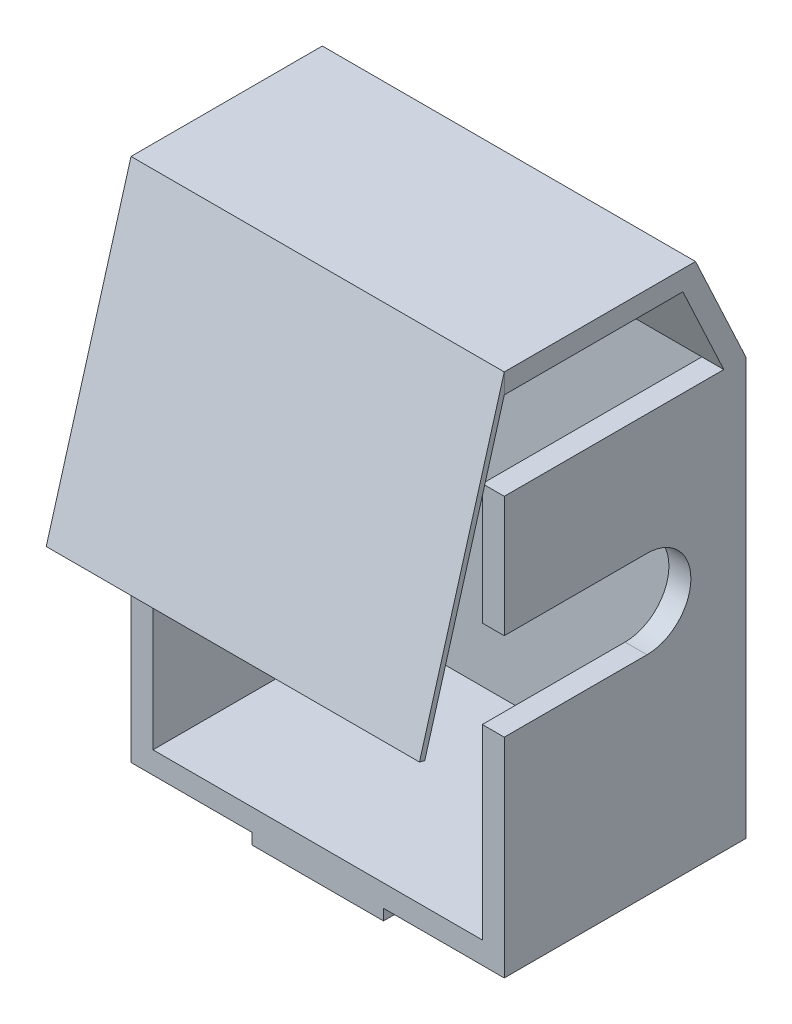
from build123d import *

# Parameters (mm, degrees)
BOSS_EXTRUDE1_DEPTH = 69.85
BOSS_EXTRUDE2_DEPTH = 228.6
BOSS_EXTRUDE3_DEPTH = 215.9
BOSS_EXTRUDE4_DEPTH = 215.9
CUT_EXTRUDE1_DEPTH  = 12.7


with BuildPart() as part:
    # Sketch1 → Boss-Extrude1 (new, symmetric)
    with BuildSketch(Plane.XY):
        Polygon((-107.95, 19.05), (107.95, 19.05), (107.95, 6.35), (38.1, 6.35), (38.1, 0), (-38.1, 0), (-38.1, 6.35), (-107.95, 6.35), align=None)
    extrude(amount=BOSS_EXTRUDE1_DEPTH, both=True)

    # Sketch2 → Boss-Extrude2 (add)
    with BuildSketch(Plane(origin=(0, 19.05, 0), x_dir=(1, 0, 0), z_dir=(0, 1, 0))):
        Polygon((107.95, 69.85), (-107.95, 69.85), (-107.95, -69.85), (-95.25, -69.85), (-95.25, 57.15), (95.25, 57.15), (95.25, -69.85), (107.95, -69.85), align=None)
    extrude(amount=BOSS_EXTRUDE2_DEPTH)

    # Sketch3 → Boss-Extrude3 (add, through all)
    with BuildSketch(Plane(origin=(107.95, 0, 0), x_dir=(0, 0, -1), z_dir=(1, 0, 0))):
        Polygon((57.15, 247.65), (69.85, 247.65), (40.794319042, 309.960108895), (-69.85, 309.960108895), (-69.85, 298.45), (33.461570966, 298.45), align=None)
    extrude(amount=-BOSS_EXTRUDE3_DEPTH)

    # Sketch5 → Cut-Extrude1 (cut)
    with BuildSketch(Plane(origin=(107.95, 0, 0), x_dir=(0, 0, -1), z_dir=(1, 0, 0))):
        with BuildLine():
            Line((12.7, 177.8), (-69.85, 177.8))
            Line((-69.85, 177.8), (-69.85, 127))
            Line((-69.85, 127), (12.7, 127))
            ThreePointArc((12.7, 127), (38.1, 152.4), (12.7, 177.8))
        make_face()
    extrude(amount=-CUT_EXTRUDE1_DEPTH, mode=Mode.SUBTRACT)


with BuildPart() as body_2:
    # Sketch4 → Boss-Extrude4 (new body)
    with BuildSketch(Plane(origin=(107.95, 0, 0), x_dir=(0, 0, -1), z_dir=(1, 0, 0))):
        Polygon((-69.85, 298.45), (-69.85, 309.960108895), (-118.895148498, 139.058343519), (-115.843331259, 138.182537296), align=None)
    extrude(amount=-BOSS_EXTRUDE4_DEPTH)


solid = Compound([part.part, body_2.part])
